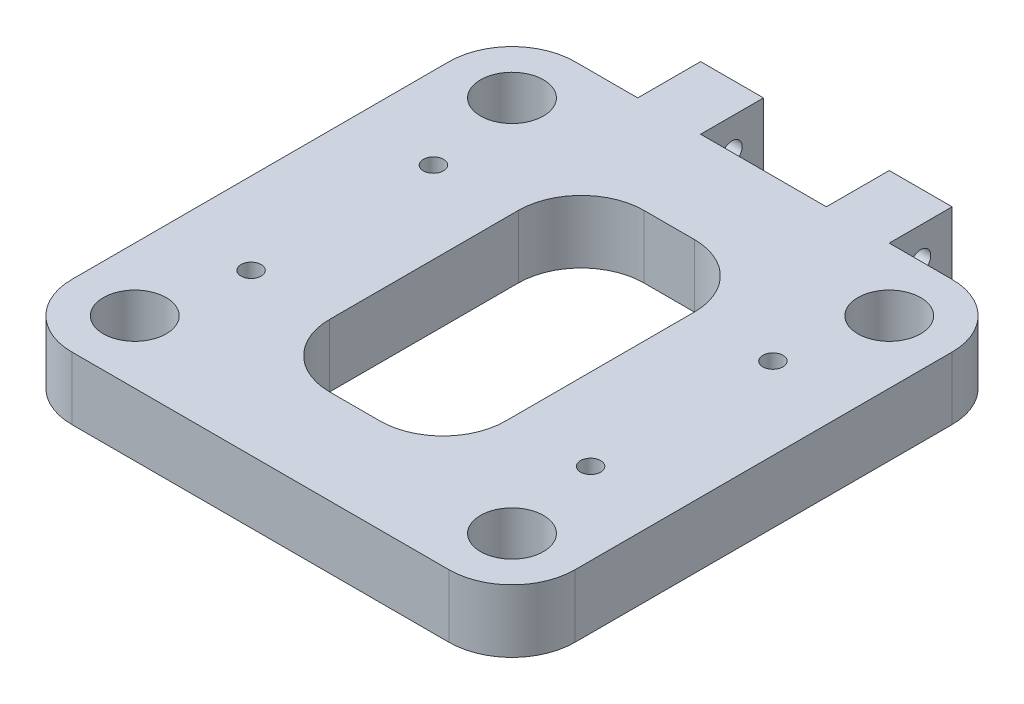
from build123d import *

# Parameters (mm, degrees)
SKETCH_1_W               = 80
SKETCH_1_H               = 80
EXTRUDE_1_DEPTH          = 10
FILLET_1_R               = 10
CUT_EXTRUDE_2_DEPTH      = 58.445626465
SKETCH_4_R               = 5
CUT_EXTRUDE_5_DEPTH      = 58.445626465
SKETCH_5_R               = 1.6
CUT_EXTRUDE_3_DEPTH      = 58.445626465
SKETCH_6_W               = 10
SKETCH_6_H               = 10
EXTRUDE_3_DEPTH          = 10
CUT_EXTRUDE_4_DEPTH      = 65.807406984
CUT_EXTRUDE_4_DEPTH_BACK = 65.807406984
SKETCH_7_R               = 1.6


with BuildPart() as part:
    # ｽｹｯﾁ1 → ﾎﾞｽ - 押し出し1 (new body)
    with BuildSketch(Plane(origin=(0, 0, 0), x_dir=(1, 0, 0), z_dir=(0, 1, 0))):
        Rectangle(SKETCH_1_W, SKETCH_1_H)
    extrude(amount=EXTRUDE_1_DEPTH)

    # ﾌｨﾚｯﾄ1
    fillet_1_edges = [part.edges().sort_by_distance(p)[0] for p in [
        (40, 5, 40),
        (-40, 5, 40),
        (-40, 5, -40),
        (40, 5, -40),
    ]]
    fillet(fillet_1_edges, radius=FILLET_1_R)

    # ｽｹｯﾁ3 → ｶｯﾄ - 押し出し2 (cut, through all)
    with BuildSketch(Plane(origin=(0, 10, 0), x_dir=(1, 0, 0), z_dir=(0, 1, 0))):
        with BuildLine():
            Line((-4, -25), (4, -25))
            ThreePointArc((4, -25), (11.071067812, -22.071067812), (14, -15))
            Line((14, -15), (14, 15))
            ThreePointArc((14, 15), (11.071067812, 22.071067812), (4, 25))
            Line((4, 25), (-4, 25))
            ThreePointArc((-4, 25), (-11.071067812, 22.071067812), (-14, 15))
            Line((-14, 15), (-14, -15))
            ThreePointArc((-14, -15), (-11.071067812, -22.071067812), (-4, -25))
        make_face()
    extrude(amount=-CUT_EXTRUDE_2_DEPTH, mode=Mode.SUBTRACT)

    # ｽｹｯﾁ4 → ｶｯﾄ - 押し出し5 (cut, through all)
    with BuildSketch(Plane(origin=(0, 10, 0), x_dir=(1, 0, 0), z_dir=(0, 1, 0))):
        with Locations(Location((-30, 30, 0), (0, 0, 270))):
            Circle(SKETCH_4_R)
        with Locations(Location((30, 30, 0), (0, 0, 270))):
            Circle(SKETCH_4_R)
        with Locations(Location((-30, -30, 0), (0, 0, 270))):
            Circle(SKETCH_4_R)
        with Locations(Location((30, -30, 0), (0, 0, 270))):
            Circle(SKETCH_4_R)
    extrude(amount=-CUT_EXTRUDE_5_DEPTH, mode=Mode.SUBTRACT)

    # ｽｹｯﾁ5 → ｶｯﾄ - 押し出し3 (cut, through all)
    with BuildSketch(Plane.XZ):
        with Locations(Location((27, 14.5, 0), (0, 0, 270))):
            Circle(SKETCH_5_R)
        with Locations(Location((-27, 14.5, 0), (0, 0, 270))):
            Circle(SKETCH_5_R)
        with Locations(Location((-27, -14.5, 0), (0, 0, 270))):
            Circle(SKETCH_5_R)
        with Locations(Location((27, -14.5, 0), (0, 0, 270))):
            Circle(SKETCH_5_R)
    extrude(amount=-CUT_EXTRUDE_3_DEPTH, mode=Mode.SUBTRACT)

    # ｽｹｯﾁ6 → ﾎﾞｽ - 押し出し3 (add)
    with BuildSketch(Plane(origin=(0, 0, -40), x_dir=(-1, 0, 0), z_dir=(0, 0, -1))):
        with Locations((-15, 5)):
            Rectangle(SKETCH_6_W, SKETCH_6_H)
        with Locations((15, 5)):
            Rectangle(SKETCH_6_W, SKETCH_6_H)
    extrude(amount=EXTRUDE_3_DEPTH)

    # ｽｹｯﾁ7 → ｶｯﾄ - 押し出し4 (cut, two sides: drawn at the far end of the back side and taken through both)
    with BuildSketch(Plane(origin=(0, 0, 0), x_dir=(0, 0, -1), z_dir=(1, 0, 0)).offset(-CUT_EXTRUDE_4_DEPTH_BACK)):
        with Locations((45, 5)):
            Circle(SKETCH_7_R)
    extrude(amount=CUT_EXTRUDE_4_DEPTH + CUT_EXTRUDE_4_DEPTH_BACK, mode=Mode.SUBTRACT)


solid = part.part
